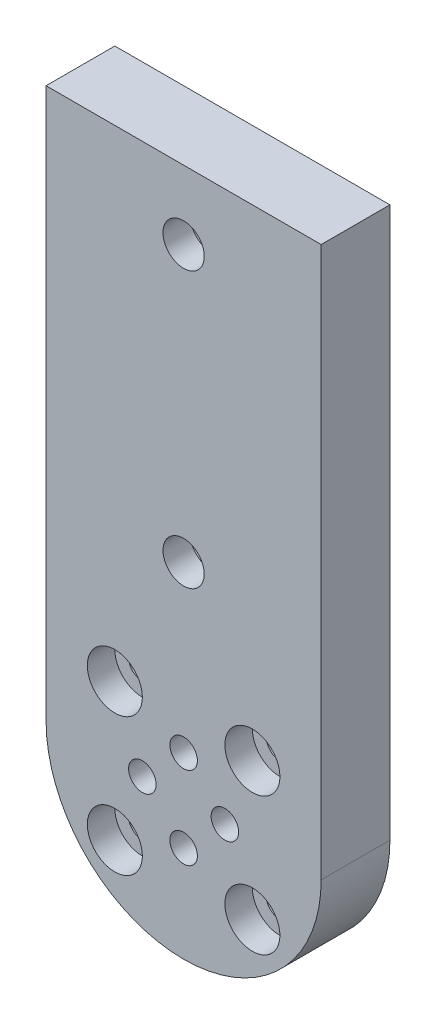
from build123d import *

# Parameters (mm, degrees)
SKETCH2_R           = 10
SKETCH2_R_2         = 1
SKETCH2_R_3         = 1.5
BOSS_EXTRUDE1_DEPTH = 5
SKETCH5_R           = 2
SKETCH5_R_2         = 1
CUT_EXTRUDE2_DEPTH  = 2
SKETCH6_R           = 3.5
CUT_EXTRUDE3_DEPTH  = 3


with BuildPart() as part:
    # Sketch2 → Boss-Extrude1 (new body)
    # profile 1 of 2: a face of its own
    with BuildSketch(Plane.XY):
        Circle(SKETCH2_R)
        with Locations((5, -5)):
            Circle(SKETCH2_R_2, mode=Mode.SUBTRACT)
        with Locations((-5, -5)):
            Circle(SKETCH2_R_2, mode=Mode.SUBTRACT)
        with Locations((5, 5)):
            Circle(SKETCH2_R_2, mode=Mode.SUBTRACT)
        with Locations((-5, 5)):
            Circle(SKETCH2_R_2, mode=Mode.SUBTRACT)
    # profile 2 of 2: a face of its own
    with BuildSketch(Plane.XY):
        with BuildLine():
            Line((-10, 40), (-10, 0))
            ThreePointArc((-10, 0), (0, 10), (10, 0))
            Line((10, 0), (10, 40))
            Line((10, 40), (-10, 40))
        make_face()
        with Locations((0, 15)):
            Circle(SKETCH2_R_3, mode=Mode.SUBTRACT)
        with Locations((0, 35)):
            Circle(SKETCH2_R_3, mode=Mode.SUBTRACT)
    extrude(amount=BOSS_EXTRUDE1_DEPTH)

    # Sketch5 → Cut-Extrude2 (cut)
    with BuildSketch(Plane.XY.offset(5)):
        with Locations((-5, 5)):
            Circle(SKETCH5_R)
        with Locations((5, 5)):
            Circle(SKETCH5_R)
        with Locations((5, -5)):
            Circle(SKETCH5_R)
        with Locations((-5, -5)):
            Circle(SKETCH5_R)
        with Locations((0, 3)):
            Circle(SKETCH5_R_2)
        with Locations((-3, 0)):
            Circle(SKETCH5_R_2)
        with Locations((3, 0)):
            Circle(SKETCH5_R_2)
        with Locations((0, -3)):
            Circle(SKETCH5_R_2)
    extrude(amount=-CUT_EXTRUDE2_DEPTH, mode=Mode.SUBTRACT)

    # Sketch6 → Cut-Extrude3 (cut)
    with BuildSketch(Plane(origin=(0, 0, 0), x_dir=(-1, 0, 0), z_dir=(0, 0, -1))):
        with Locations((0, 35)):
            Circle(SKETCH6_R)
        with Locations((0, 15)):
            Circle(SKETCH6_R)
    extrude(amount=-CUT_EXTRUDE3_DEPTH, mode=Mode.SUBTRACT)


solid = part.part
